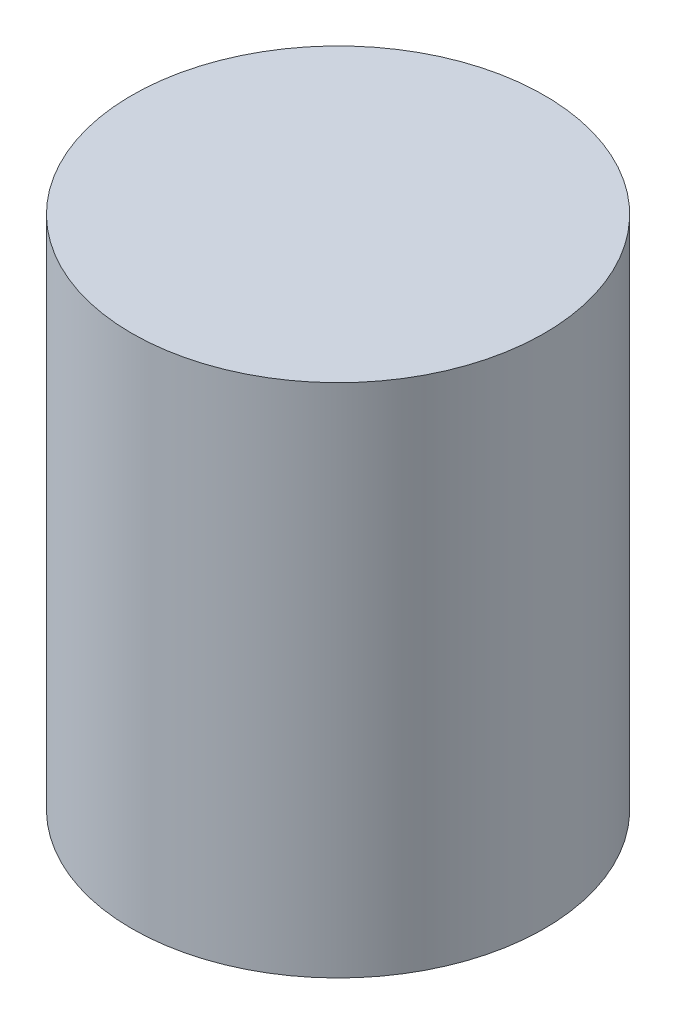
from build123d import *

# Parameters (mm, degrees)
PRESS_PZP400_PISTON_MILI_START = 1020
SKETCH1_R                      = 20
PRESS_PZP400_PISTON_MILI_DEPTH = 50


with BuildPart() as part:
    # Sketch1 → PRESS_PZP400_piston_mili (new body)
    with BuildSketch(Plane(origin=(0, 0, 0), x_dir=(1, 0, 0), z_dir=(0, 1, 0)).offset(PRESS_PZP400_PISTON_MILI_START)):
        with Locations(Location((350, 280, 0), (0, 0, 270))):
            Circle(SKETCH1_R)
    extrude(amount=PRESS_PZP400_PISTON_MILI_DEPTH)


solid = part.part
